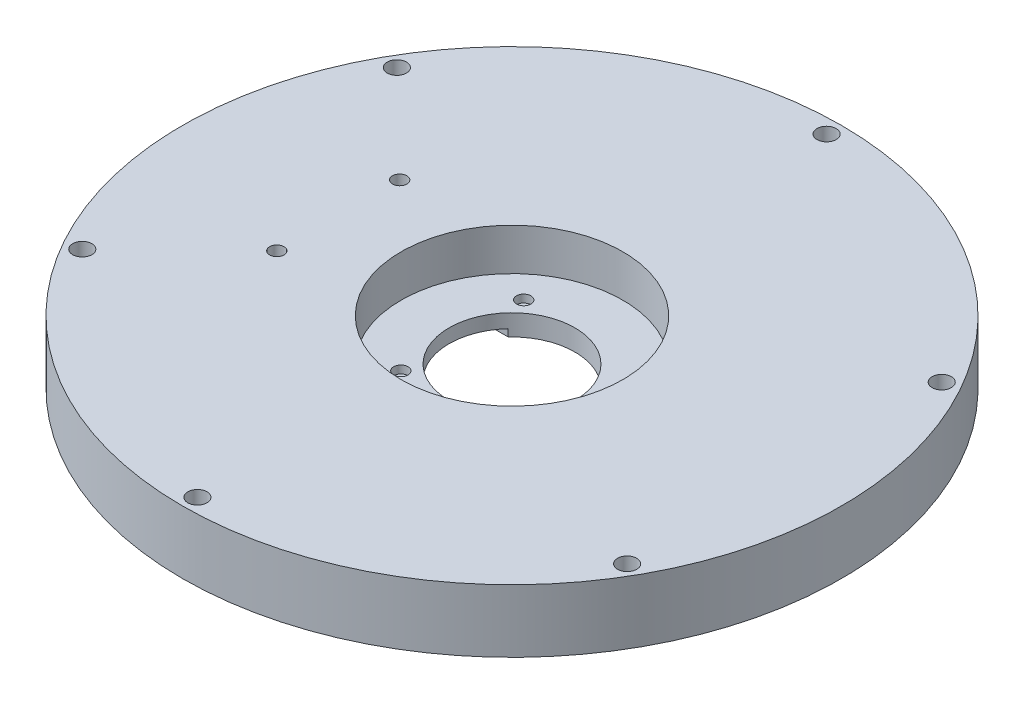
from build123d import *

# Parameters (mm, degrees)
SKETCH1_R           = 55
SKETCH1_R_2         = 50
SKETCH1_R_3         = 1.6
BOSS_EXTRUDE1_DEPTH = 7.5
SKETCH2_3_R         = 50
SKETCH2_3_R_2       = 10.5
BOSS_EXTRUDE2_DEPTH = 7.5
SKETCH2_R           = 0.5
CUT_EXTRUDE1_DEPTH  = 7.5
SKETCH2_3_2_R       = 1.2
SKETCH2_3_2_R_2     = 0.5
CUT_EXTRUDE2_DEPTH  = 5.3
CUT_EXTRUDE3_START  = -1.2
CUT_EXTRUDE3_DEPTH  = 1.2
SKETCH4_R           = 18.5
CUT_EXTRUDE4_DEPTH  = 4
BOSS_EXTRUDE3_START = 3
SKETCH5_R           = 55
SKETCH5_R_2         = 18.5
SKETCH5_R_3         = 1.6
SKETCH5_R_4         = 1.2
BOSS_EXTRUDE3_DEPTH = 3


with BuildPart() as part:
    # Sketch1 → Boss-Extrude1 (new body)
    with BuildSketch(Plane(origin=(0, 0, 0), x_dir=(1, 0, 0), z_dir=(0, 1, 0))):
        with Locations(Location((0, 0, 0), (0, 0, 270))):
            Circle(SKETCH1_R)
        with Locations(Location((0, 0, 0), (0, 0, 270))):
            Circle(SKETCH1_R_2, mode=Mode.SUBTRACT)
        with Locations(Location((0, 52.5, 0), (0, 0, 270))):
            Circle(SKETCH1_R_3, mode=Mode.SUBTRACT)
        with Locations(Location((45.466333699, 26.25, 0), (0, 0, 270))):
            Circle(SKETCH1_R_3, mode=Mode.SUBTRACT)
        with Locations(Location((45.466333699, -26.25, 0), (0, 0, 270))):
            Circle(SKETCH1_R_3, mode=Mode.SUBTRACT)
        with Locations(Location((0, -52.5, 0), (0, 0, 270))):
            Circle(SKETCH1_R_3, mode=Mode.SUBTRACT)
        with Locations(Location((-45.466333699, -26.25, 0), (0, 0, 270))):
            Circle(SKETCH1_R_3, mode=Mode.SUBTRACT)
        with Locations(Location((-45.466333699, 26.25, 0), (0, 0, 270))):
            Circle(SKETCH1_R_3, mode=Mode.SUBTRACT)
    extrude(amount=-BOSS_EXTRUDE1_DEPTH)

    # Sketch2_3 → Boss-Extrude2 (add)
    with BuildSketch(Plane(origin=(0, 0, 0), x_dir=(1, 0, 0), z_dir=(0, 1, 0))):
        Circle(SKETCH2_3_R)
        with Locations(Location((0, 0, 0), (0, 0, 270))):
            Circle(SKETCH2_3_R_2, mode=Mode.SUBTRACT)
    extrude(amount=-BOSS_EXTRUDE2_DEPTH)

    # Sketch2 → Cut-Extrude1 (cut)
    with BuildSketch(Plane(origin=(0, 0, 0), x_dir=(1, 0, 0), z_dir=(0, 1, 0))):
        with Locations(Location((-29, 10.25, 0), (0, 0, 270))):
            Circle(SKETCH2_R)
        with Locations(Location((-8.3, 10.25, 0), (0, 0, 270))):
            Circle(SKETCH2_R)
        with Locations(Location((-8.3, -10.25, 0), (0, 0, 270))):
            Circle(SKETCH2_R)
        with Locations(Location((-29, -10.25, 0), (0, 0, 270))):
            Circle(SKETCH2_R)
    extrude(amount=-CUT_EXTRUDE1_DEPTH, mode=Mode.SUBTRACT)

    # Sketch2_3 2 → Cut-Extrude2 (cut)
    # profile 1 of 4: a face of its own
    with BuildSketch(Plane(origin=(0, 0, 0), x_dir=(1, 0, 0), z_dir=(0, 1, 0))):
        with Locations(Location((-29, 10.25, 0), (0, 0, 270))):
            Circle(SKETCH2_3_2_R)
        with Locations(Location((-29, 10.25, 0), (0, 0, 270))):
            Circle(SKETCH2_3_2_R_2, mode=Mode.SUBTRACT)
    # profile 2 of 4: a face of its own
    with BuildSketch(Plane(origin=(0, 0, 0), x_dir=(1, 0, 0), z_dir=(0, 1, 0))):
        with Locations(Location((-8.3, 10.25, 0), (0, 0, 270))):
            Circle(SKETCH2_3_2_R)
        with Locations(Location((-8.3, 10.25, 0), (0, 0, 270))):
            Circle(SKETCH2_3_2_R_2, mode=Mode.SUBTRACT)
    # profile 3 of 4: a face of its own
    with BuildSketch(Plane(origin=(0, 0, 0), x_dir=(1, 0, 0), z_dir=(0, 1, 0))):
        with Locations(Location((-8.3, -10.25, 0), (0, 0, 270))):
            Circle(SKETCH2_3_2_R)
        with Locations(Location((-8.3, -10.25, 0), (0, 0, 270))):
            Circle(SKETCH2_3_2_R_2, mode=Mode.SUBTRACT)
    # profile 4 of 4: a face of its own
    with BuildSketch(Plane(origin=(0, 0, 0), x_dir=(1, 0, 0), z_dir=(0, 1, 0))):
        with Locations(Location((-29, -10.25, 0), (0, 0, 270))):
            Circle(SKETCH2_3_2_R)
        with Locations(Location((-29, -10.25, 0), (0, 0, 270))):
            Circle(SKETCH2_3_2_R_2, mode=Mode.SUBTRACT)
    extrude(amount=-CUT_EXTRUDE2_DEPTH, mode=Mode.SUBTRACT)

    # Sketch3 → Cut-Extrude3 (cut)
    with BuildSketch(Plane.XZ.offset(7.5).offset(CUT_EXTRUDE3_START)):
        with BuildLine():
            Line((-34.6, 0), (-10.5, 0))
            ThreePointArc((-10.5, 0), (-9.784532036, 3.809584338), (-7.735631842, 7.1))
            Line((-7.735631842, 7.1), (-34.6, 7.1))
            Line((-34.6, 7.1), (-34.6, 0))
        make_face()
        with BuildLine():
            ThreePointArc((-7.735631842, -7.1), (-9.784532036, -3.809584338), (-10.5, 0))
            Line((-10.5, 0), (-34.6, 0))
            Line((-34.6, 0), (-34.6, -7.1))
            Line((-34.6, -7.1), (-7.735631842, -7.1))
        make_face()
    extrude(amount=CUT_EXTRUDE3_DEPTH, mode=Mode.SUBTRACT)

    # Sketch4 → Cut-Extrude4 (cut)
    with BuildSketch(Plane(origin=(0, 0, 0), x_dir=(1, 0, 0), z_dir=(0, 1, 0))):
        with Locations(Location((0, 0, 0), (0, 0, 270))):
            Circle(SKETCH4_R)
    extrude(amount=-CUT_EXTRUDE4_DEPTH, mode=Mode.SUBTRACT)

    # Sketch5 → Boss-Extrude3 (add)
    with BuildSketch(Plane(origin=(0, 0, 0), x_dir=(1, 0, 0), z_dir=(0, 1, 0)).offset(BOSS_EXTRUDE3_START)):
        with Locations(Location((0, 0, 0), (0, 0, 270))):
            Circle(SKETCH5_R)
        with Locations(Location((0, 0, 0), (0, 0, 270))):
            Circle(SKETCH5_R_2, mode=Mode.SUBTRACT)
        with Locations(Location((0, 52.5, 0), (0, 0, 270))):
            Circle(SKETCH5_R_3, mode=Mode.SUBTRACT)
        with Locations(Location((-45.466333699, -26.25, 0), (0, 0, 270))):
            Circle(SKETCH5_R_3, mode=Mode.SUBTRACT)
        with Locations(Location((45.466333699, -26.25, 0), (0, 0, 270))):
            Circle(SKETCH5_R_3, mode=Mode.SUBTRACT)
        with Locations(Location((-29, -10.25, 0), (0, 0, 270))):
            Circle(SKETCH5_R_4, mode=Mode.SUBTRACT)
        with Locations(Location((45.466333699, 26.25, 0), (0, 0, 270))):
            Circle(SKETCH5_R_3, mode=Mode.SUBTRACT)
        with Locations(Location((0, -52.5, 0), (0, 0, 270))):
            Circle(SKETCH5_R_3, mode=Mode.SUBTRACT)
        with Locations(Location((-45.466333699, 26.25, 0), (0, 0, 270))):
            Circle(SKETCH5_R_3, mode=Mode.SUBTRACT)
        with Locations(Location((-29, 10.25, 0), (0, 0, 270))):
            Circle(SKETCH5_R_4, mode=Mode.SUBTRACT)
    extrude(amount=-BOSS_EXTRUDE3_DEPTH)


solid = part.part
